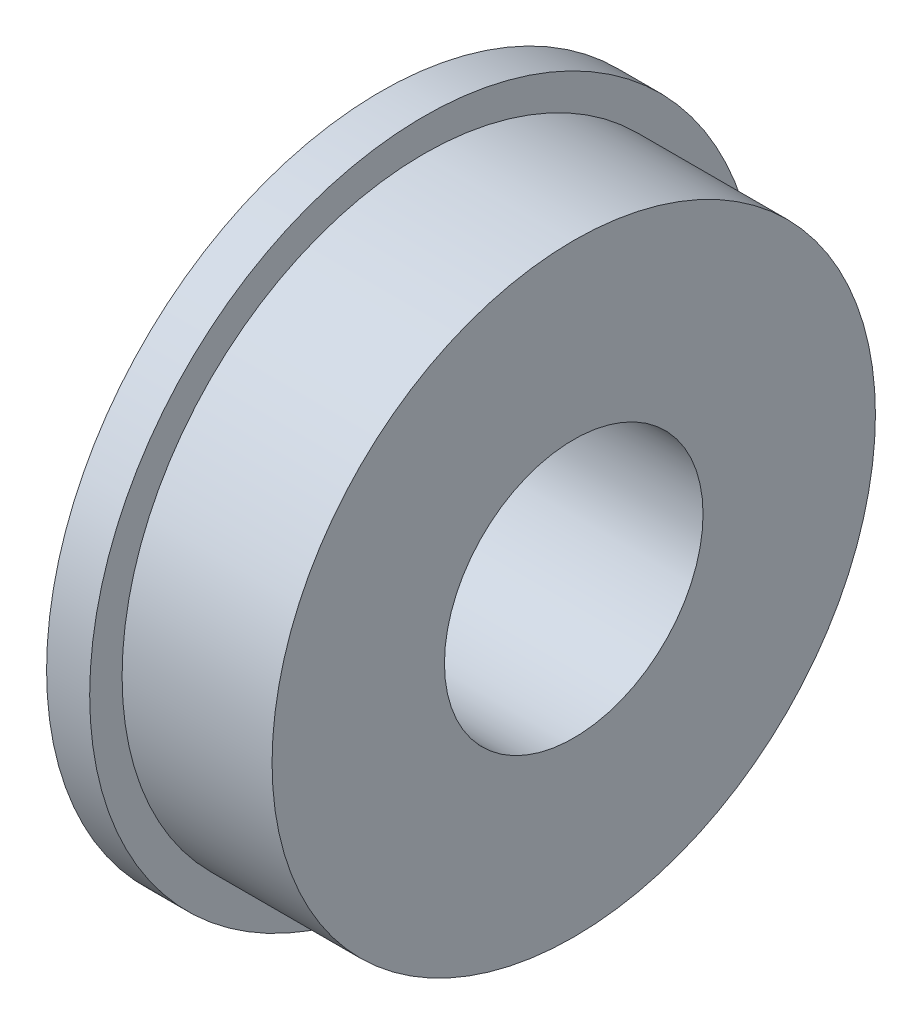
from build123d import *


with BuildPart() as part:
    # Sketch1 → Revolve1 (revolve)
    with BuildSketch(Plane(origin=(0, 0, 0), x_dir=(-1, 0, 0), z_dir=(0, 0, -1)), mode=Mode.PRIVATE) as revolve1_sk:
        Polygon((-0.381, 6.35), (-0.381, 9.906), (0, 9.906), (0, 12.3063), (-1.5875, 12.3063), (-1.5875, 11.1125), (-7.112, 11.1125), (-7.112, 4.7625), (0, 4.7625), (0, 6.35), align=None)
    revolve(revolve1_sk.sketch.rotate(Axis((7.112, 0, 0), (-1, 0, 0)), 270), axis=Axis((7.112, 0, 0), (-1, 0, 0)))


solid = part.part
